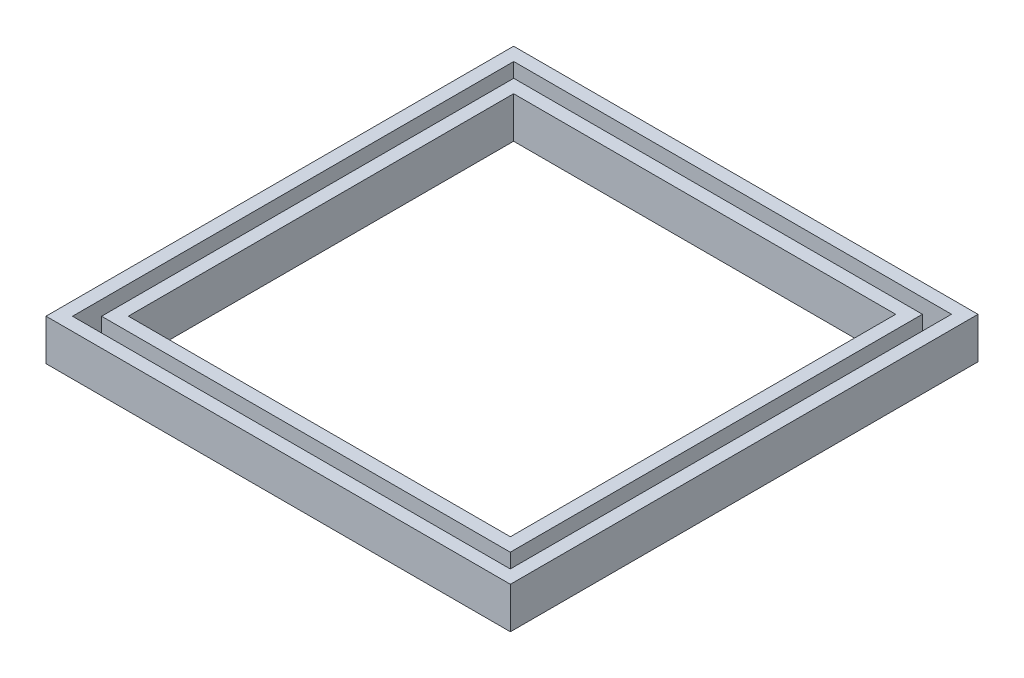
from build123d import *

# Parameters (mm, degrees)
SKETCH1_W             = 189.14
SKETCH1_H             = 190.74
SKETCH1_W_2           = 176.82
SKETCH1_H_2           = 178.315780904
BOSS_EXTRUDE2_DEPTH   = 19.05
SKETCH1_W_3           = 214.92
SKETCH1_H_3           = 216.415780904
SKETCH1_W_4           = 202.6
SKETCH1_H_4           = 204.2
BOSS_EXTRUDE2_2_DEPTH = 19.05


with BuildPart() as part:
    # Sketch1 → Boss-Extrude2 (new body)
    with BuildSketch(Plane(origin=(0, 0, 0), x_dir=(1, 0, 0), z_dir=(0, 1, 0))):
        Rectangle(SKETCH1_W, SKETCH1_H)
        Rectangle(SKETCH1_W_2, SKETCH1_H_2, mode=Mode.SUBTRACT)
    extrude(amount=BOSS_EXTRUDE2_DEPTH)


with BuildPart() as body_2:
    # Sketch1 → Boss-Extrude2 2 (new body)
    with BuildSketch(Plane(origin=(0, 0, 0), x_dir=(1, 0, 0), z_dir=(0, 1, 0))):
        Rectangle(SKETCH1_W_3, SKETCH1_H_3)
        Rectangle(SKETCH1_W_4, SKETCH1_H_4, mode=Mode.SUBTRACT)
    extrude(amount=BOSS_EXTRUDE2_2_DEPTH)


solid = Compound([part.part, body_2.part])
